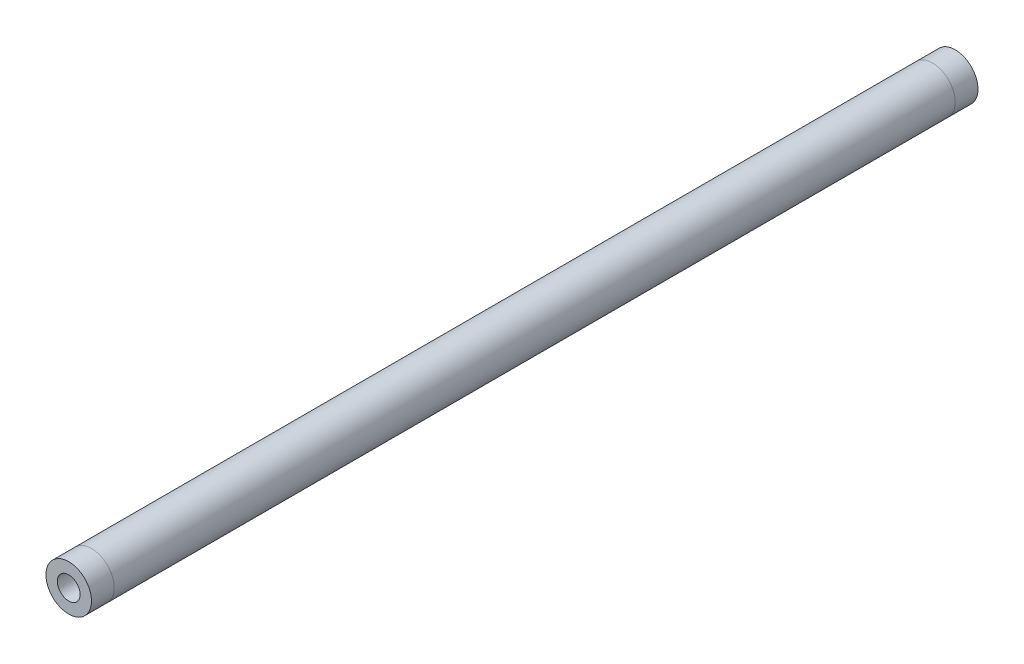
from build123d import *

# Parameters (mm, degrees)
SKETCH1_R                 = 6.35
SKETCH1_R_2               = 4.8768
SKETCH1_R_3               = 3.175
THREADED_INSERT_1_1_DEPTH = 6.35
THREADED_START            = -6.35
SKETCH1_3_R               = 4.8768
SKETCH1_3_R_2             = 3.175
THREADED_INSERT_1_2_DEPTH = 6.35
TUBE_START                = -6.35
SKETCH1_4_R               = 6.35
SKETCH1_4_R_2             = 4.8768
TUBE_EXTRUDE_DEPTH        = 234.63379
THREADED_START_2          = -240.98379
SKETCH1_6_R               = 4.8768
SKETCH1_6_R_2             = 3.175
THREADED_INSERT_2_1_DEPTH = 6.35
SKETCH1_9_R               = 6.35
SKETCH1_9_R_2             = 4.8768
SKETCH1_9_R_3             = 3.175
THREADED_INSERT_2_2_DEPTH = 6.35


with BuildPart() as part:
    # Sketch1 → Threaded insert 1-1 (new body)
    # profile 1 of 2: a face of its own
    with BuildSketch(Plane.XY):
        Circle(SKETCH1_R)
        Circle(SKETCH1_R_2, mode=Mode.SUBTRACT)
    # profile 2 of 2: a face of its own
    with BuildSketch(Plane.XY):
        Circle(SKETCH1_R_2)
        Circle(SKETCH1_R_3, mode=Mode.SUBTRACT)
    extrude(amount=-THREADED_INSERT_1_1_DEPTH)

    # Sketch1<3> → Threaded insert 1-2 (add)
    with BuildSketch(Plane.XY.offset(THREADED_START)):
        Circle(SKETCH1_3_R)
        Circle(SKETCH1_3_R_2, mode=Mode.SUBTRACT)
    extrude(amount=-THREADED_INSERT_1_2_DEPTH)


with BuildPart() as body_2:
    # Sketch1<4> → Tube extrude (new body)
    with BuildSketch(Plane.XY.offset(TUBE_START)):
        Circle(SKETCH1_4_R)
        Circle(SKETCH1_4_R_2, mode=Mode.SUBTRACT)
    extrude(amount=-TUBE_EXTRUDE_DEPTH)


with BuildPart() as body_3:
    # Sketch1<6> → Threaded insert 2-1 (new body)
    with BuildSketch(Plane.XY.offset(THREADED_START_2)):
        Circle(SKETCH1_6_R)
        Circle(SKETCH1_6_R_2, mode=Mode.SUBTRACT)
    extrude(amount=THREADED_INSERT_2_1_DEPTH)


with BuildPart() as body_4:
    # Sketch1<9> → Threaded insert 2-2 (new body)
    # profile 1 of 2: a face of its own
    with BuildSketch(Plane.XY.offset(THREADED_START_2)):
        Circle(SKETCH1_9_R)
        Circle(SKETCH1_9_R_2, mode=Mode.SUBTRACT)
    # profile 2 of 2: a face of its own
    with BuildSketch(Plane.XY.offset(THREADED_START_2)):
        Circle(SKETCH1_9_R_2)
        Circle(SKETCH1_9_R_3, mode=Mode.SUBTRACT)
    extrude(amount=-THREADED_INSERT_2_2_DEPTH)

    # Combine1: union body 3
    add(body_3.part)


solid = Compound([part.part, body_2.part, body_4.part])
